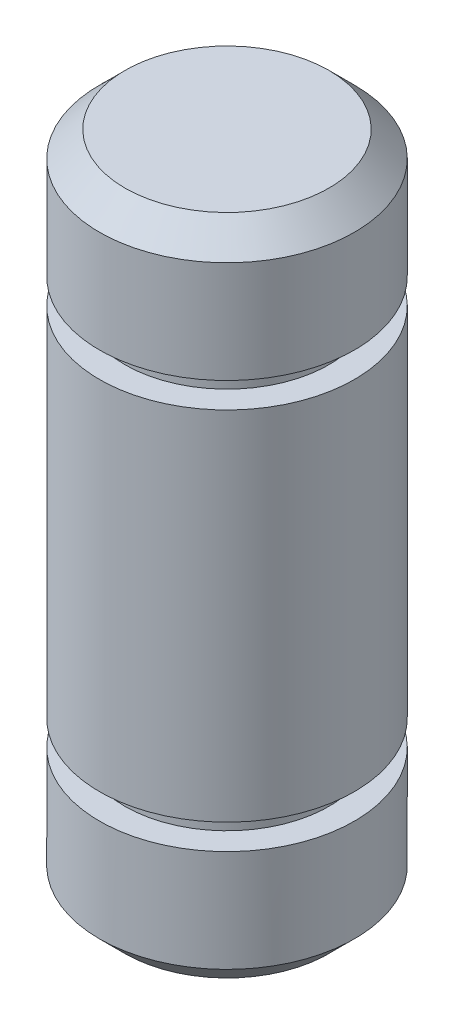
from build123d import *

# Parameters (mm, degrees)
SKETCH1_R           = 5
BOSS_EXTRUDE1_DEPTH = 26
CHAMFER1_SIZE       = 1
CUT_EXTRUDE1_START  = -5
SKETCH2_R           = 6
SKETCH2_R_2         = 4
CUT_EXTRUDE1_DEPTH  = 1
CUT_EXTRUDE2_START  = -20
SKETCH2_2_R         = 6
SKETCH2_2_R_2       = 4
CUT_EXTRUDE2_DEPTH  = 1


with BuildPart() as part:
    # Sketch1 → Boss-Extrude1 (new body)
    with BuildSketch(Plane(origin=(0, 0, 0), x_dir=(1, 0, 0), z_dir=(0, 1, 0))):
        Circle(SKETCH1_R)
    extrude(amount=BOSS_EXTRUDE1_DEPTH)

    # Chamfer1
    chamfer1_edges = [part.edges().sort_by_distance(p)[0] for p in [
        (-5, 0, 0),
        (-5, 26, 0),
    ]]
    chamfer(chamfer1_edges, length=CHAMFER1_SIZE)

    # Sketch2 → Cut-Extrude1 (cut)
    with BuildSketch(Plane.XZ.offset(CUT_EXTRUDE1_START)):
        Circle(SKETCH2_R)
        Circle(SKETCH2_R_2, mode=Mode.SUBTRACT)
    extrude(amount=-CUT_EXTRUDE1_DEPTH, mode=Mode.SUBTRACT)

    # Sketch2<2> → Cut-Extrude2 (cut)
    with BuildSketch(Plane.XZ.offset(CUT_EXTRUDE2_START)):
        Circle(SKETCH2_2_R)
        Circle(SKETCH2_2_R_2, mode=Mode.SUBTRACT)
    extrude(amount=-CUT_EXTRUDE2_DEPTH, mode=Mode.SUBTRACT)


solid = part.part
